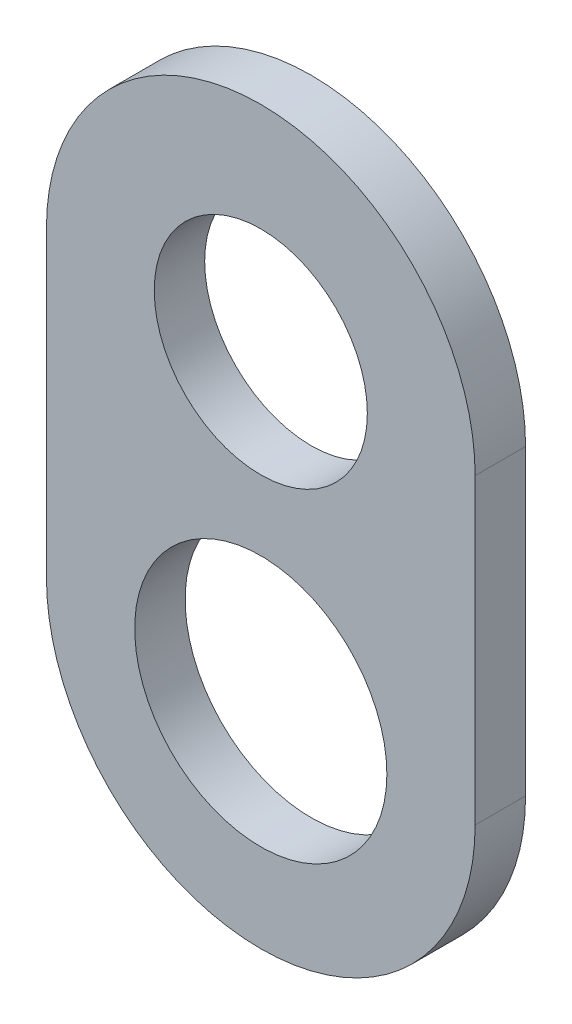
from build123d import *

# Parameters (mm, degrees)
SKETCH1_R           = 10.7315
SKETCH1_R_2         = 12.7
BOSS_EXTRUDE1_DEPTH = 5.08


with BuildPart() as part:
    # Sketch1 → Boss-Extrude1 (new body)
    with BuildSketch(Plane.XY):
        with BuildLine():
            Line((-21.59, -30.48), (-21.59, 0))
            ThreePointArc((-21.59, 0), (0, 21.59), (21.59, 0))
            Line((21.59, 0), (21.59, -30.48))
            ThreePointArc((21.59, -30.48), (0, -52.07), (-21.59, -30.48))
        make_face()
        Circle(SKETCH1_R, mode=Mode.SUBTRACT)
        with Locations((0, -30.48)):
            Circle(SKETCH1_R_2, mode=Mode.SUBTRACT)
    extrude(amount=BOSS_EXTRUDE1_DEPTH)


solid = part.part
